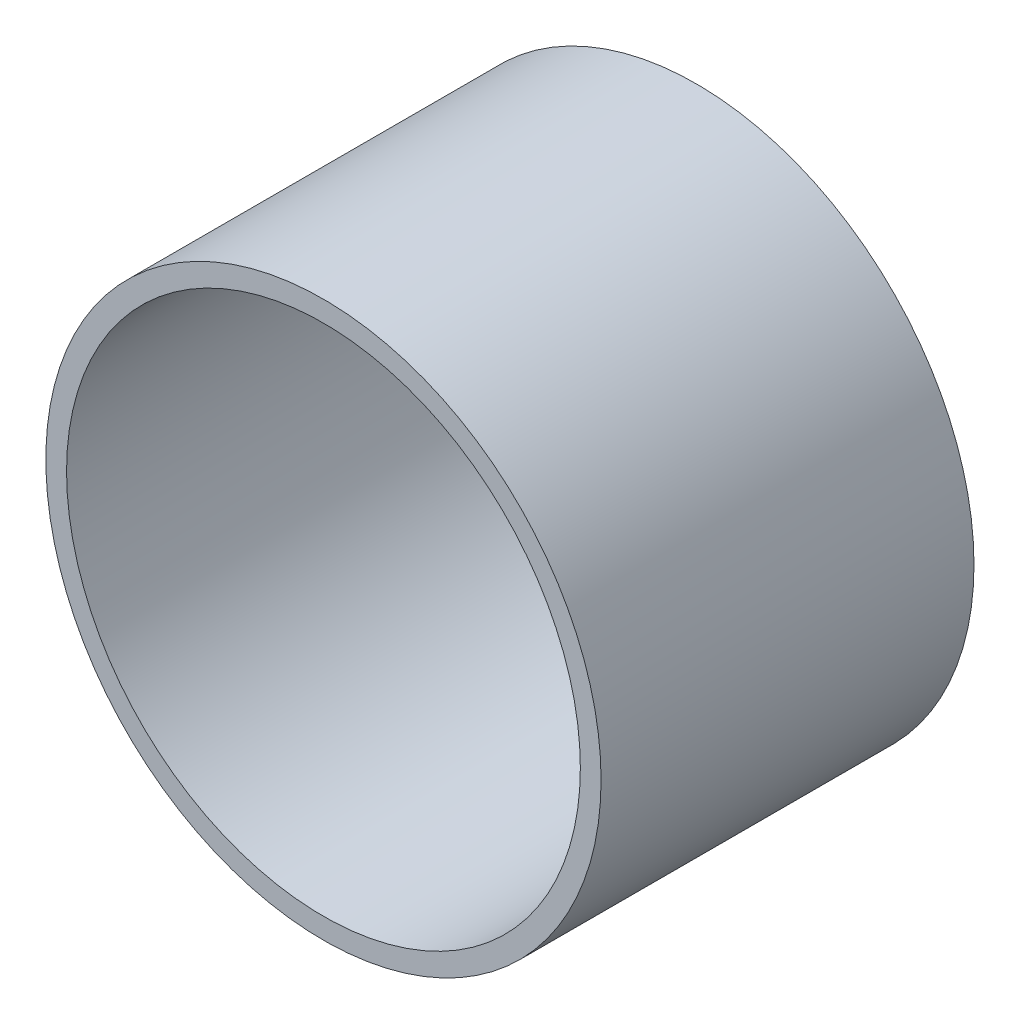
from build123d import *

# Parameters (mm, degrees)
BOSS_EXTRUDE1_START = -22.5
SKETCH1_R           = 33.5
SKETCH1_R_2         = 31
BOSS_EXTRUDE1_DEPTH = 45


with BuildPart() as part:
    # Sketch1 → Boss-Extrude1 (new body)
    with BuildSketch(Plane.XY.offset(BOSS_EXTRUDE1_START)):
        Circle(SKETCH1_R)
        Circle(SKETCH1_R_2, mode=Mode.SUBTRACT)
    extrude(amount=BOSS_EXTRUDE1_DEPTH)


solid = part.part
